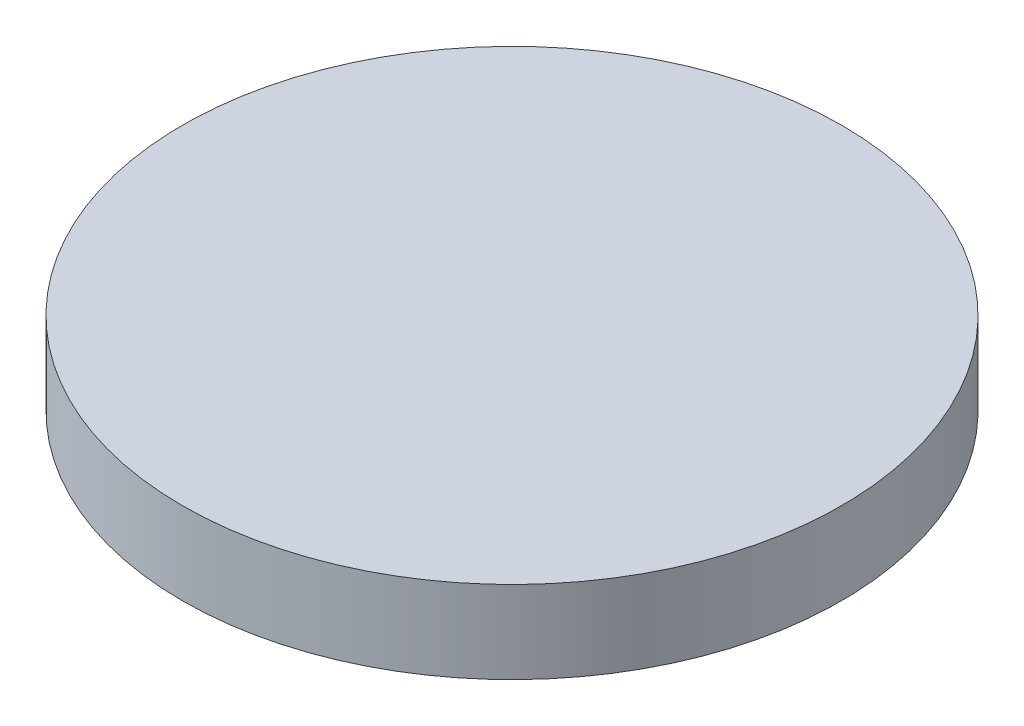
from build123d import *

# Parameters (mm, degrees)
SKETCH1_R           = 4
BOSS_EXTRUDE1_DEPTH = 1


with BuildPart() as part:
    # Sketch1 → Boss-Extrude1 (new body)
    with BuildSketch(Plane(origin=(0, 0, 0), x_dir=(1, 0, 0), z_dir=(0, 1, 0))):
        with Locations(Location((0, 0, 0), (0, 0, 270))):
            Circle(SKETCH1_R)
    extrude(amount=BOSS_EXTRUDE1_DEPTH)


solid = part.part
